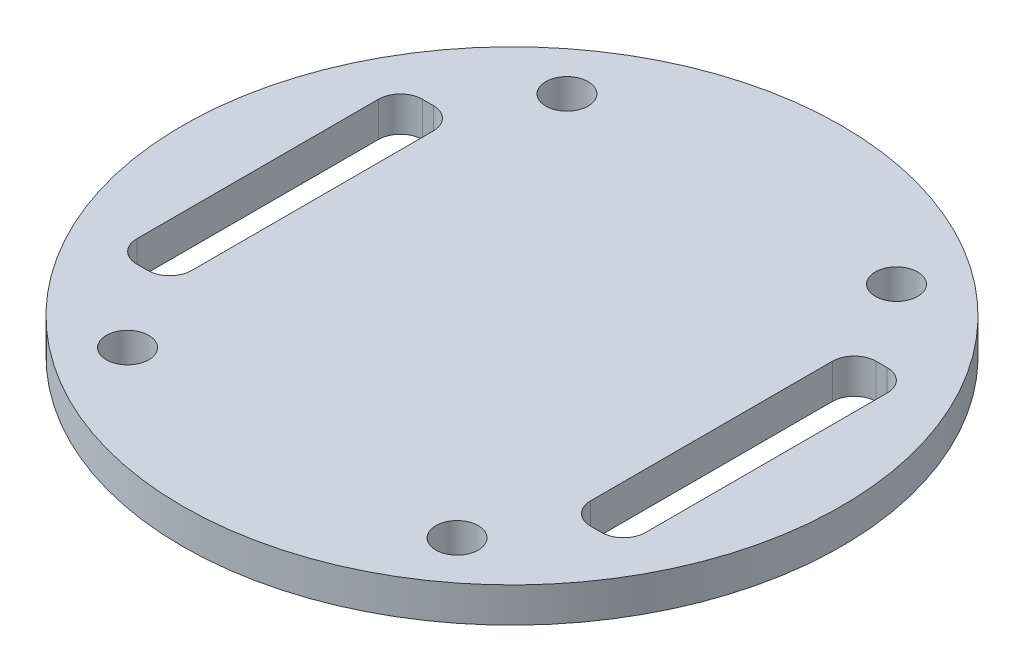
from build123d import *

# Parameters (mm, degrees)
SKETCH2_R          = 30
ACRYLICBASE_DEPTH  = 1.5875
SKETCH3_W          = 5
SKETCH3_H          = 26
WHEELS_DEPTH       = 43.545042308
RELIEFS_R          = 2
SKETCH4_R          = 1.9304
CUT_EXTRUDE1_DEPTH = 43.545042308


with BuildPart() as part:
    # Sketch2 → AcrylicBase (new, symmetric)
    with BuildSketch(Plane(origin=(0, 0, 0), x_dir=(1, 0, 0), z_dir=(0, 1, 0))):
        Circle(SKETCH2_R)
    extrude(amount=ACRYLICBASE_DEPTH, both=True)

    # Sketch3 → wheels (cut, through all)
    with BuildSketch(Plane(origin=(0, 1.5875, 0), x_dir=(1, 0, 0), z_dir=(0, 1, 0))):
        with Locations((-20.657104633, 0)):
            Rectangle(SKETCH3_W, SKETCH3_H)
        with Locations((20.657104633, 0)):
            Rectangle(SKETCH3_W, SKETCH3_H)
    extrude(amount=-WHEELS_DEPTH, mode=Mode.SUBTRACT)

    # reliefs
    reliefs_edges = [part.edges().sort_by_distance(p)[0] for p in [
        (18.157104633, 0, -13),
        (23.157104633, 0, -13),
        (23.157104633, 0, 13),
        (18.157104633, 0, 13),
        (-23.157104633, 0, 13),
        (-18.157104633, 0, 13),
        (-18.157104633, 0, -13),
        (-23.157104633, 0, -13),
    ]]
    fillet(reliefs_edges, radius=RELIEFS_R)

    # Sketch4 → Cut-Extrude1 (cut, through all)
    with BuildSketch(Plane(origin=(0, 1.5875, 0), x_dir=(1, 0, 0), z_dir=(0, 1, 0))):
        with Locations((-15, 20)):
            Circle(SKETCH4_R)
        with Locations((-15, -20)):
            Circle(SKETCH4_R)
        with Locations((15, -20)):
            Circle(SKETCH4_R)
        with Locations((15, 20)):
            Circle(SKETCH4_R)
    extrude(amount=-CUT_EXTRUDE1_DEPTH, mode=Mode.SUBTRACT)


solid = part.part
